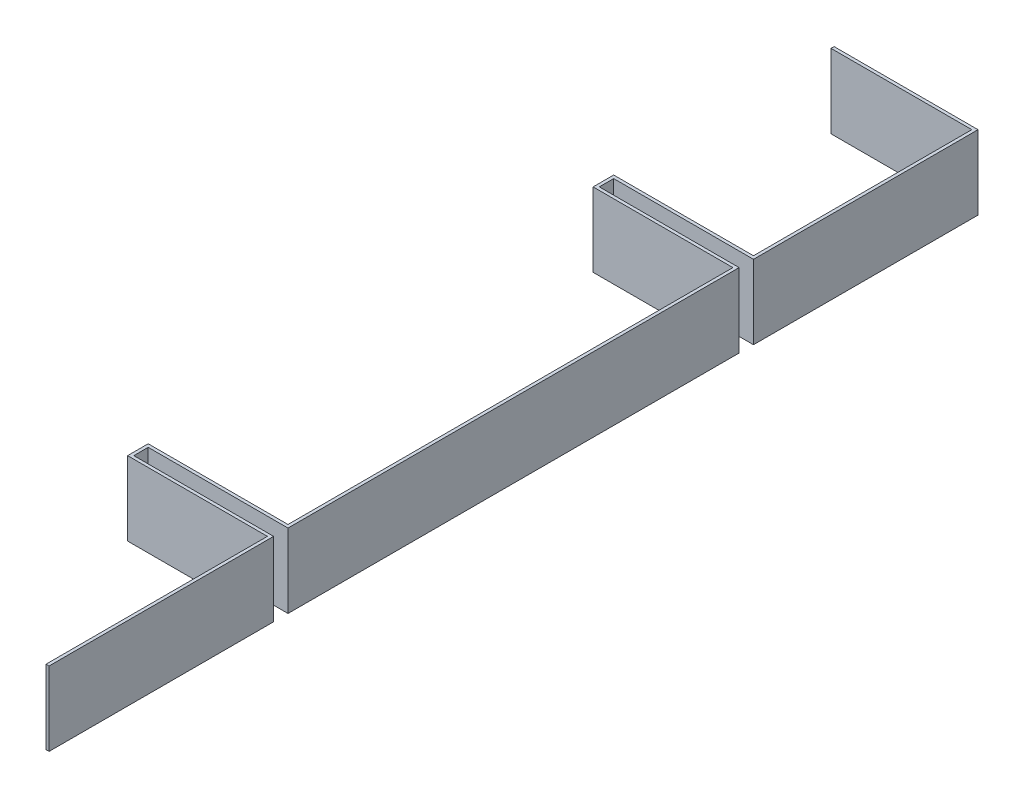
from build123d import *

# Parameters (mm, degrees)
BOSS_EXTRUDE1_DEPTH = 457.2


with BuildPart() as part:
    # Sketch1 → Boss-Extrude1 (new body)
    with BuildSketch(Plane(origin=(0, 0, 0), x_dir=(1, 0, 0), z_dir=(0, 1, 0))):
        Polygon((0, 0), (0, 1386.84), (-863.6, 1386.84), (-863.6, 1475.74), (0, 1475.74), (0, 4262.12), (-863.6, 4262.12), (-863.6, 4351.02), (0, 4351.02), (0, 5737.86), (-889, 5737.86), (-889, 5718.81), (-19.05, 5718.81), (-19.05, 4370.07), (-882.65, 4370.07), (-882.65, 4243.07), (-19.05, 4243.07), (-19.05, 1494.79), (-882.65, 1494.79), (-882.65, 1367.79), (-19.05, 1367.79), (-19.05, 0), align=None)
    extrude(amount=BOSS_EXTRUDE1_DEPTH)


solid = part.part
